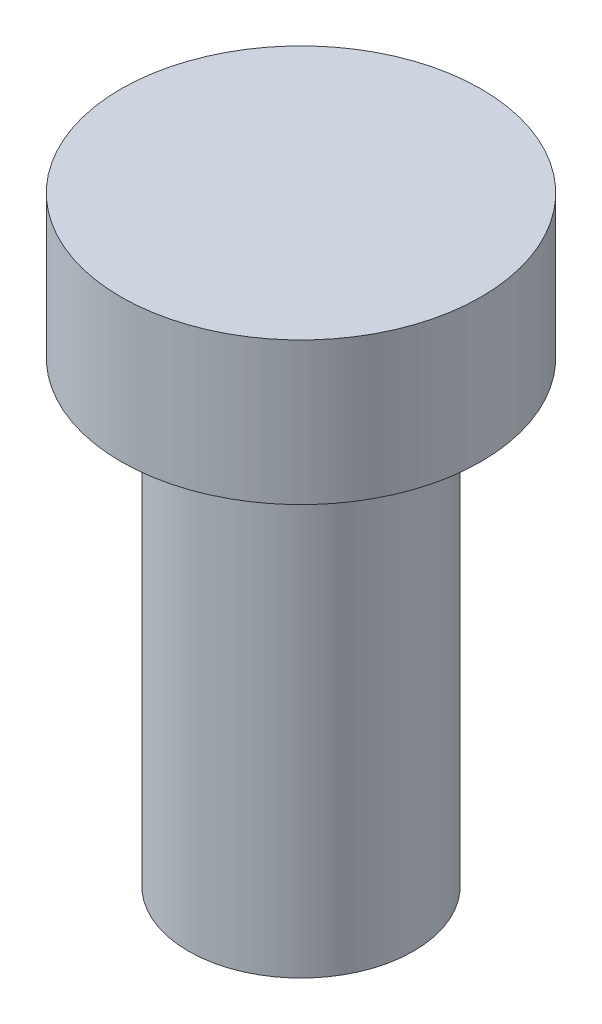
from build123d import *

# Parameters (mm, degrees)
ESQUISSE1_R        = 2.4
BOSS_EXTRU_1_DEPTH = 1.9
ESQUISSE2_R        = 1.5
BOSS_EXTRU_2_DEPTH = 6.1


with BuildPart() as part:
    # Esquisse1 → Boss.-Extru.1 (new body)
    with BuildSketch(Plane(origin=(0, 0, 0), x_dir=(1, 0, 0), z_dir=(0, 1, 0))):
        with Locations(Location((0, 0, 0), (0, 0, 90))):
            Circle(ESQUISSE1_R)
    extrude(amount=BOSS_EXTRU_1_DEPTH)

    # Esquisse2 → Boss.-Extru.2 (add)
    with BuildSketch(Plane.XZ):
        with Locations(Location((0, 0, 0), (0, 0, 270))):
            Circle(ESQUISSE2_R)
    extrude(amount=BOSS_EXTRU_2_DEPTH)


solid = part.part
